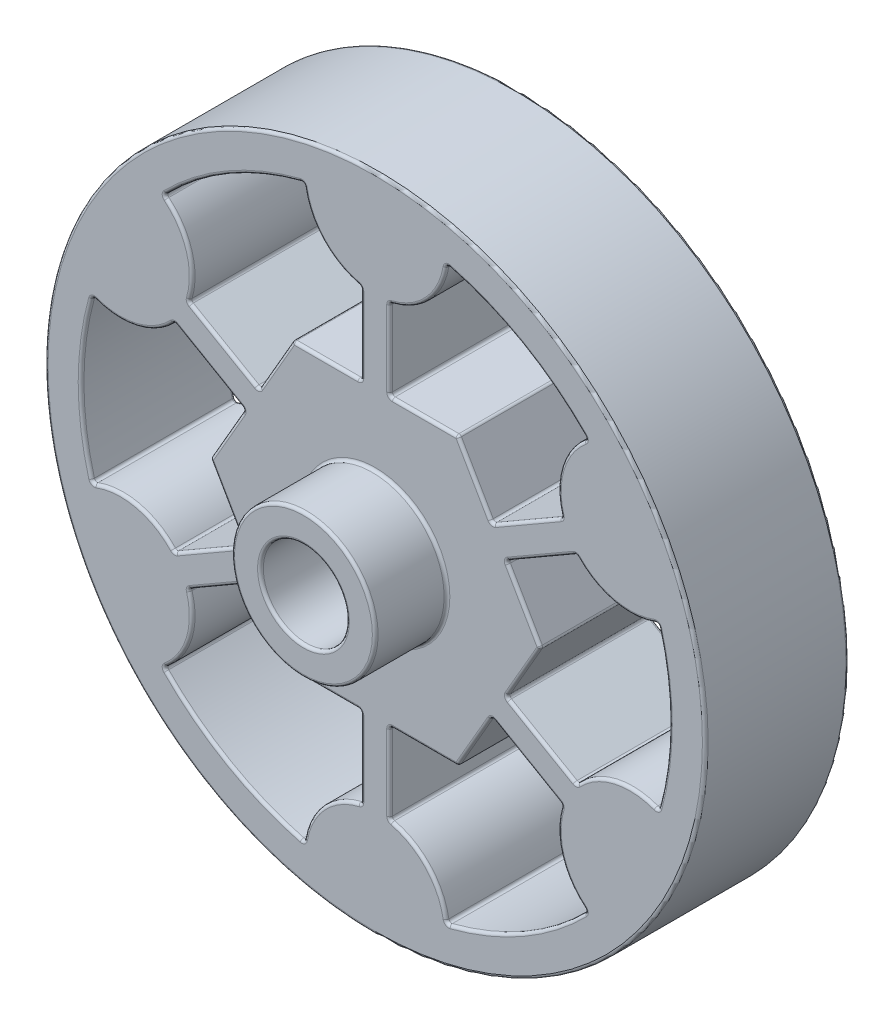
from build123d import *

# Parameters (mm, degrees)
SKETCH1_3_R         = 23
SKETCH1_3_R_2       = 5
BOSS_EXTRUDE2_DEPTH = 5
SKETCH1_4_R         = 5
SKETCH1_4_R_2       = 3
BOSS_EXTRUDE3_DEPTH = 10
FILLET3_R           = 0.2


with BuildPart() as part:
    # Sketch1<3> → Boss-Extrude2 (new, symmetric)
    with BuildSketch(Plane.XY):
        Circle(SKETCH1_3_R)
        with BuildLine():
            Line((-8.125, -5.845671476), (-5.75, -9.959292144))
            Line((-5.75, -9.959292144), (-1, -9.959292144))
            Line((-1, -9.959292144), (-1, -15.601020514))
            ThreePointArc((-1, -15.601020514), (-3.672567076, -17.107029168), (-4.962680475, -19.890243902))
            ThreePointArc((-4.962680475, -19.890243902), (-10.25, -17.753520778), (-14.744116269, -14.242929314))
            ThreePointArc((-14.744116269, -14.242929314), (-12.978838304, -11.734050969), (-13.01088009, -8.666535661))
            Line((-13.01088009, -8.666535661), (-8.125, -5.845671476))
        make_face(mode=Mode.SUBTRACT)
        with BuildLine():
            Line((1, -9.959292144), (5.75, -9.959292144))
            Line((5.75, -9.959292144), (8.125, -5.845671476))
            Line((8.125, -5.845671476), (13.01088009, -8.666535661))
            ThreePointArc((13.01088009, -8.666535661), (12.978838304, -11.734050969), (14.744116269, -14.242929314))
            ThreePointArc((14.744116269, -14.242929314), (10.25, -17.753520778), (4.962680475, -19.890243902))
            ThreePointArc((4.962680475, -19.890243902), (3.672567076, -17.107029168), (1, -15.601020514))
            Line((1, -15.601020514), (1, -9.959292144))
        make_face(mode=Mode.SUBTRACT)
        with BuildLine():
            Line((9.125, -4.113620668), (11.5, 0))
            Line((11.5, 0), (9.125, 4.113620668))
            Line((9.125, 4.113620668), (14.01088009, 6.934484853))
            ThreePointArc((14.01088009, 6.934484853), (16.651405381, 5.372978199), (19.706796745, 5.647314589))
            ThreePointArc((19.706796745, 5.647314589), (20.5, 0), (19.706796745, -5.647314589))
            ThreePointArc((19.706796745, -5.647314589), (16.651405381, -5.372978199), (14.01088009, -6.934484853))
            Line((14.01088009, -6.934484853), (9.125, -4.113620668))
        make_face(mode=Mode.SUBTRACT)
        with BuildLine():
            Line((-14.01088009, 6.934484853), (-9.125, 4.113620668))
            Line((-9.125, 4.113620668), (-11.5, 0))
            Line((-11.5, 0), (-9.125, -4.113620668))
            Line((-9.125, -4.113620668), (-14.01088009, -6.934484853))
            ThreePointArc((-14.01088009, -6.934484853), (-16.651405381, -5.372978199), (-19.706796745, -5.647314589))
            ThreePointArc((-19.706796745, -5.647314589), (-20.5, 0), (-19.706796745, 5.647314589))
            ThreePointArc((-19.706796745, 5.647314589), (-16.651405381, 5.372978199), (-14.01088009, 6.934484853))
        make_face(mode=Mode.SUBTRACT)
        with BuildLine():
            Line((-1, 9.959292144), (-5.75, 9.959292144))
            Line((-5.75, 9.959292144), (-8.125, 5.845671476))
            Line((-8.125, 5.845671476), (-13.01088009, 8.666535661))
            ThreePointArc((-13.01088009, 8.666535661), (-12.978838304, 11.734050969), (-14.744116269, 14.242929314))
            ThreePointArc((-14.744116269, 14.242929314), (-10.25, 17.753520778), (-4.962680475, 19.890243902))
            ThreePointArc((-4.962680475, 19.890243902), (-3.672567076, 17.107029168), (-1, 15.601020514))
            Line((-1, 15.601020514), (-1, 9.959292144))
        make_face(mode=Mode.SUBTRACT)
        Circle(SKETCH1_3_R_2, mode=Mode.SUBTRACT)
        with BuildLine():
            Line((8.125, 5.845671476), (5.75, 9.959292144))
            Line((5.75, 9.959292144), (1, 9.959292144))
            Line((1, 9.959292144), (1, 15.601020514))
            ThreePointArc((1, 15.601020514), (3.672567076, 17.107029168), (4.962680475, 19.890243902))
            ThreePointArc((4.962680475, 19.890243902), (10.25, 17.753520778), (14.744116269, 14.242929314))
            ThreePointArc((14.744116269, 14.242929314), (12.978838304, 11.734050969), (13.01088009, 8.666535661))
            Line((13.01088009, 8.666535661), (8.125, 5.845671476))
        make_face(mode=Mode.SUBTRACT)
    extrude(amount=BOSS_EXTRUDE2_DEPTH, both=True)

    # Sketch1<4> → Boss-Extrude3 (add, symmetric)
    with BuildSketch(Plane.XY):
        Circle(SKETCH1_4_R)
        Circle(SKETCH1_4_R_2, mode=Mode.SUBTRACT)
    extrude(amount=BOSS_EXTRUDE3_DEPTH, both=True)

    # Fillet3
    fillet3_edges = [part.edges().sort_by_distance(p)[0] for p in [
        (-14.744116269, -14.242929314, 0),
        (-13.01088009, -8.666535661, 0),
        (-8.125, -5.845671476, 0),
        (-5.75, -9.959292144, 0),
        (-1, -9.959292144, 0),
        (-1, -15.601020514, 0),
        (-4.962680475, -19.890243902, 0),
        (4.962680475, -19.890243902, 0),
        (1, -15.601020514, 0),
        (1, -9.959292144, 0),
        (5.75, -9.959292144, 0),
        (8.125, -5.845671476, 0),
        (13.01088009, -8.666535661, 0),
        (14.744116269, -14.242929314, 0),
        (19.706796745, -5.647314589, 0),
        (14.01088009, -6.934484853, 0),
        (9.125, -4.113620668, 0),
        (11.5, 0, 0),
        (9.125, 4.113620668, 0),
        (14.01088009, 6.934484853, 0),
        (19.706796745, 5.647314589, 0),
        (14.744116269, 14.242929314, 0),
        (13.01088009, 8.666535661, 0),
        (8.125, 5.845671476, 0),
        (5.75, 9.959292144, 0),
        (1, 9.959292144, 0),
        (1, 15.601020514, 0),
        (4.962680475, 19.890243902, 0),
        (-4.962680475, 19.890243902, 0),
        (-1, 15.601020514, 0),
        (-1, 9.959292144, 0),
        (-5.75, 9.959292144, 0),
        (-8.125, 5.845671476, 0),
        (-13.01088009, 8.666535661, 0),
        (-14.744116269, 14.242929314, 0),
        (-9.125, 4.113620668, 0),
        (-11.5, 0, 0),
        (-9.125, -4.113620668, 0),
        (-14.01088009, -6.934484853, 0),
        (-19.706796745, -5.647314589, 0),
        (-19.706796745, 5.647314589, 0),
        (-14.01088009, 6.934484853, 0),
        (-23, 0, 5),
        (-3.672567076, -17.107029168, 5),
        (-1, -12.780156329, 5),
        (-3.375, -9.959292144, 5),
        (-6.9375, -7.90248181, 5),
        (-10.567940045, -7.256103568, 5),
        (-12.978838304, -11.734050969, 5),
        (-10.25, -17.753520778, 5),
        (12.978838304, -11.734050969, 5),
        (10.567940045, -7.256103568, 5),
        (6.9375, -7.90248181, 5),
        (3.375, -9.959292144, 5),
        (1, -12.780156329, 5),
        (3.672567076, -17.107029168, 5),
        (10.25, -17.753520778, 5),
        (16.651405381, 5.372978199, 5),
        (11.567940045, 5.524052761, 5),
        (10.3125, 2.056810334, 5),
        (10.3125, -2.056810334, 5),
        (11.567940045, -5.524052761, 5),
        (16.651405381, -5.372978199, 5),
        (20.5, 0, 5),
        (3.672567076, 17.107029168, 5),
        (1, 12.780156329, 5),
        (3.375, 9.959292144, 5),
        (6.9375, 7.90248181, 5),
        (10.567940045, 7.256103568, 5),
        (12.978838304, 11.734050969, 5),
        (10.25, 17.753520778, 5),
        (-12.978838304, 11.734050969, 5),
        (-10.567940045, 7.256103568, 5),
        (-6.9375, 7.90248181, 5),
        (-3.375, 9.959292144, 5),
        (-1, 12.780156329, 5),
        (-3.672567076, 17.107029168, 5),
        (-10.25, 17.753520778, 5),
        (-5, 0, 5),
        (-16.651405381, 5.372978199, 5),
        (-20.5, 0, 5),
        (-16.651405381, -5.372978199, 5),
        (-11.567940045, -5.524052761, 5),
        (-10.3125, -2.056810334, 5),
        (-10.3125, 2.056810334, 5),
        (-11.567940045, 5.524052761, 5),
        (-23, 0, -5),
        (-3.672567076, -17.107029168, -5),
        (-1, -12.780156329, -5),
        (-3.375, -9.959292144, -5),
        (-6.9375, -7.90248181, -5),
        (-10.567940045, -7.256103568, -5),
        (-12.978838304, -11.734050969, -5),
        (-10.25, -17.753520778, -5),
        (12.978838304, -11.734050969, -5),
        (10.567940045, -7.256103568, -5),
        (6.9375, -7.90248181, -5),
        (3.375, -9.959292144, -5),
        (1, -12.780156329, -5),
        (3.672567076, -17.107029168, -5),
        (10.25, -17.753520778, -5),
        (16.651405381, 5.372978199, -5),
        (11.567940045, 5.524052761, -5),
        (10.3125, 2.056810334, -5),
        (10.3125, -2.056810334, -5),
        (11.567940045, -5.524052761, -5),
        (16.651405381, -5.372978199, -5),
        (20.5, 0, -5),
        (3.672567076, 17.107029168, -5),
        (1, 12.780156329, -5),
        (3.375, 9.959292144, -5),
        (6.9375, 7.90248181, -5),
        (10.567940045, 7.256103568, -5),
        (12.978838304, 11.734050969, -5),
        (10.25, 17.753520778, -5),
        (-12.978838304, 11.734050969, -5),
        (-10.567940045, 7.256103568, -5),
        (-6.9375, 7.90248181, -5),
        (-3.375, 9.959292144, -5),
        (-1, 12.780156329, -5),
        (-3.672567076, 17.107029168, -5),
        (-10.25, 17.753520778, -5),
        (-16.651405381, 5.372978199, -5),
        (-20.5, 0, -5),
        (-16.651405381, -5.372978199, -5),
        (-11.567940045, -5.524052761, -5),
        (-10.3125, -2.056810334, -5),
        (-10.3125, 2.056810334, -5),
        (-11.567940045, 5.524052761, -5),
        (-5, 0, -5),
        (-5, 0, 10),
        (-3, 0, 10),
        (-5, 0, -10),
        (-3, 0, -10),
    ]]
    fillet(fillet3_edges, radius=FILLET3_R)


solid = part.part
